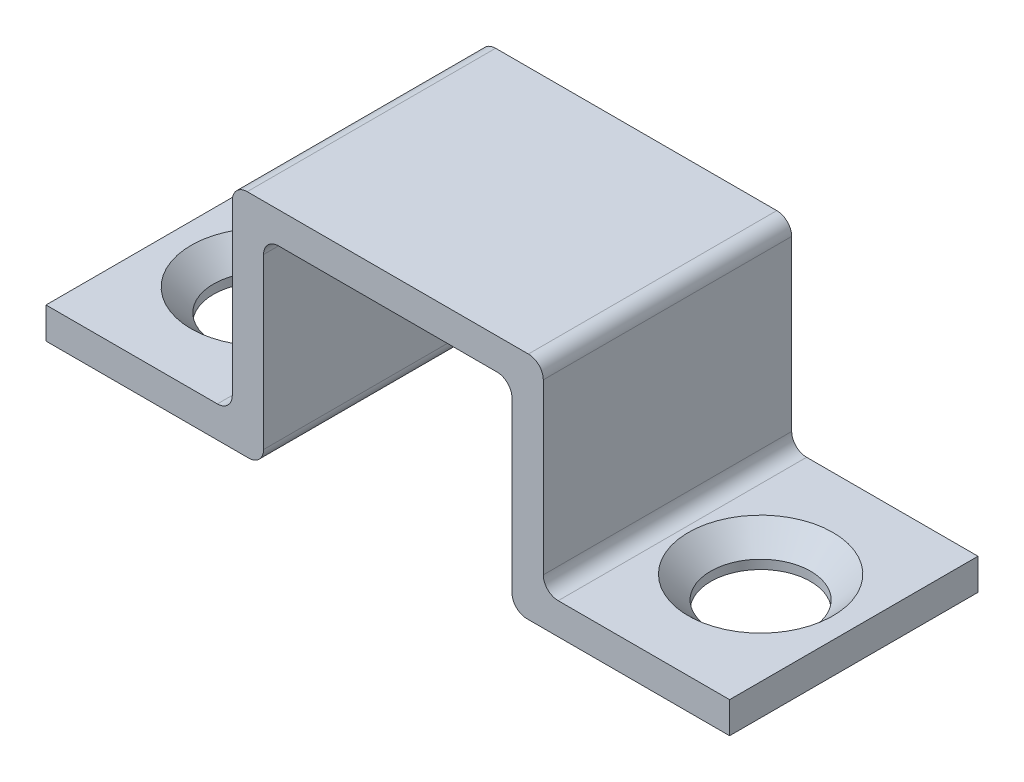
from build123d import *

# Parameters (mm, degrees)
SKETCH1_W           = 12.7
SKETCH1_H           = 12.7
BOSS_EXTRUDE1_DEPTH = 1.6002
SKETCH2_W           = 12.7
SKETCH2_H           = 11.7602
BOSS_EXTRUDE2_DEPTH = 1.6002
SKETCH3_W           = 12.7
SKETCH3_H           = 1.6002
BOSS_EXTRUDE3_DEPTH = 9.525
SKETCH4_R           = 2.5527
CUT_EXTRUDE1_DEPTH  = 22.187985158
FILLET1_R           = 0.762
CHAMFER2_SIZE       = 1.143


with BuildPart() as part:
    # Sketch1 → Boss-Extrude1 (new body)
    with BuildSketch(Plane(origin=(0, 0, 0), x_dir=(1, 0, 0), z_dir=(0, 1, 0))):
        Rectangle(SKETCH1_W, SKETCH1_H)
    extrude(amount=BOSS_EXTRUDE1_DEPTH)

    # Sketch2 → Boss-Extrude2 (add)
    with BuildSketch(Plane(origin=(6.35, 0, 0), x_dir=(0, 0, -1), z_dir=(1, 0, 0))):
        with Locations((0, -4.2799)):
            Rectangle(SKETCH2_W, SKETCH2_H)
    boss_extrude2 = extrude(amount=BOSS_EXTRUDE2_DEPTH)

    # Sketch3 → Boss-Extrude3 (add)
    with BuildSketch(Plane(origin=(7.9502, 0, 0), x_dir=(0, 0, -1), z_dir=(1, 0, 0))):
        with Locations((0, -9.3599)):
            Rectangle(SKETCH3_W, SKETCH3_H)
    boss_extrude3 = extrude(amount=BOSS_EXTRUDE3_DEPTH)

    # Sketch4 → Cut-Extrude1 (cut, through all)
    with BuildSketch(Plane(origin=(0, -8.5598, 0), x_dir=(1, 0, 0), z_dir=(0, 1, 0))):
        with Locations(Location((12.7127, 0, 0), (0, 0, 270))):
            Circle(SKETCH4_R)
    cut_extrude1 = extrude(amount=-CUT_EXTRUDE1_DEPTH, mode=Mode.SUBTRACT)

    # Mirror2: Boss-Extrude2, Boss-Extrude3, Cut-Extrude1 across plane
    add(boss_extrude2.mirror(Plane(origin=(0, 0, 0), x_dir=(0, 0, 1), z_dir=(1, 0, 0))))
    add(boss_extrude3.mirror(Plane(origin=(0, 0, 0), x_dir=(0, 0, 1), z_dir=(1, 0, 0))))
    add(cut_extrude1.mirror(Plane(origin=(0, 0, 0), x_dir=(0, 0, 1), z_dir=(1, 0, 0))), mode=Mode.SUBTRACT)

    # Fillet1
    fillet1_edges = [part.edges().sort_by_distance(p)[0] for p in [
        (6.35, -10.16, 0),
        (-6.35, -10.16, 0),
        (6.35, 0, 0),
        (-6.35, 0, 0),
        (-7.9502, -8.5598, 0),
        (-7.9502, 1.6002, 0),
        (7.9502, 1.6002, 0),
        (7.9502, -8.5598, 0),
    ]]
    fillet(fillet1_edges, radius=FILLET1_R)

    # Chamfer2
    chamfer2_edges = [part.edges().sort_by_distance(p)[0] for p in [
        (12.7127, -8.5598, -2.5527),
        (-12.7127, -8.5598, -2.5527),
    ]]
    chamfer(chamfer2_edges, length=CHAMFER2_SIZE)


solid = part.part
